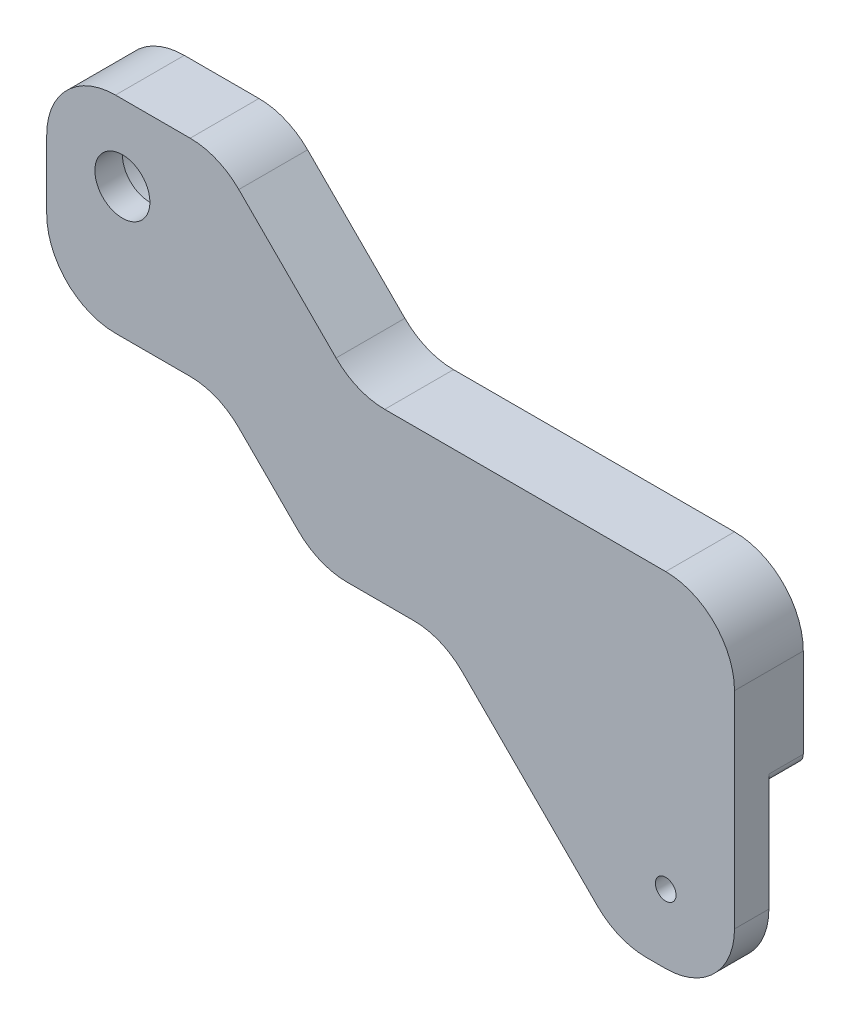
from build123d import *

# Parameters (mm, degrees)
ESQUISSE1_W                  = 200
ESQUISSE1_H                  = 100
BOSS_EXTRU_1_DEPTH           = 20
ENL_V_MAT_EXTRU_1_DEPTH      = 225.499443206
ENL_V_MAT_EXTRU_1_DEPTH_BACK = 225.499443206
ESQUISSE2_R                  = 3
ENL_V_MAT_EXTRU_2_DEPTH      = 225.499443206
ENL_V_MAT_EXTRU_2_DEPTH_BACK = 225.499443206
ENL_V_MAT_EXTRU_3_DEPTH      = 10
ENL_V_MAT_EXTRU_4_DEPTH      = 224.830292856
ENL_V_MAT_EXTRU_4_DEPTH_BACK = 224.830292856
BOSS_EXTRU_2_DEPTH           = 20
ESQUISSE7_R                  = 17.5
ENL_V_MAT_EXTRU_5_DEPTH      = 11
ENL_V_MAT_EXTRU_6_DEPTH      = 245.378804318
ENL_V_MAT_EXTRU_6_DEPTH_BACK = 245.378804318
ESQUISSE8_R                  = 8
ESQUISSE9_R                  = 14.5
ENL_V_MAT_EXTRU_7_DEPTH      = 1
CONG_1_R                     = 20
CONG_2_R                     = 3


with BuildPart() as part:
    # Esquisse1 → Boss.-Extru.1 (new body)
    with BuildSketch(Plane.XY):
        with Locations((100, 50)):
            Rectangle(ESQUISSE1_W, ESQUISSE1_H)
    extrude(amount=BOSS_EXTRU_1_DEPTH)

    # Esquisse2 → Enlèv. mat.-Extru.1 (cut, two sides: drawn at the far end of the back side and taken through both)
    with BuildSketch(Plane.XY.offset(20).offset(-ENL_V_MAT_EXTRU_1_DEPTH_BACK)):
        with Locations((180, 20)):
            Circle(ESQUISSE2_R)
    extrude(amount=ENL_V_MAT_EXTRU_1_DEPTH + ENL_V_MAT_EXTRU_1_DEPTH_BACK, mode=Mode.SUBTRACT)

    # Esquisse3 → Enlèv. mat.-Extru.2 (cut, two sides: drawn at the far end of the back side and taken through both)
    with BuildSketch(Plane.XY.offset(20).offset(-ENL_V_MAT_EXTRU_2_DEPTH_BACK)):
        Polygon((130, 0), (50, 80), (0, 80), (0, 0), align=None)
    extrude(amount=ENL_V_MAT_EXTRU_2_DEPTH + ENL_V_MAT_EXTRU_2_DEPTH_BACK, mode=Mode.SUBTRACT)

    # Esquisse4 → Enlèv. mat.-Extru.3 (cut)
    with BuildSketch(Plane(origin=(0, 0, 0), x_dir=(-1, 0, 0), z_dir=(0, 0, -1))):
        Polygon((-130, 0), (-79, 51), (-200, 51), (-200, 0), align=None)
    extrude(amount=-ENL_V_MAT_EXTRU_3_DEPTH, mode=Mode.SUBTRACT)

    # Esquisse5 → Enlèv. mat.-Extru.4 (cut, two sides: drawn at the far end of the back side and taken through both)
    with BuildSketch(Plane(origin=(0, 0, 10), x_dir=(-1, 0, 0), z_dir=(0, 0, -1)).offset(-ENL_V_MAT_EXTRU_4_DEPTH_BACK)):
        Polygon((-130, 0), (-166, 0), (-115, 51), (-79, 51), align=None)
    extrude(amount=ENL_V_MAT_EXTRU_4_DEPTH + ENL_V_MAT_EXTRU_4_DEPTH_BACK, mode=Mode.SUBTRACT)

    # Esquisse6 → Boss.-Extru.2 (add)
    with BuildSketch(Plane.XY.offset(20)):
        Polygon((0, 100), (90, 100), (50, 140), (0, 140), align=None)
    extrude(amount=-BOSS_EXTRU_2_DEPTH)

    # Esquisse7 → Enlèv. mat.-Extru.5 (cut)
    with BuildSketch(Plane(origin=(0, 0, 0), x_dir=(-1, 0, 0), z_dir=(0, 0, -1))):
        with Locations((-22, 118)):
            Circle(ESQUISSE7_R)
    extrude(amount=-ENL_V_MAT_EXTRU_5_DEPTH, mode=Mode.SUBTRACT)

    # Esquisse8 → Enlèv. mat.-Extru.6 (cut, two sides: drawn at the far end of the back side and taken through both)
    with BuildSketch(Plane(origin=(0, 0, 11), x_dir=(-1, 0, 0), z_dir=(0, 0, -1)).offset(-ENL_V_MAT_EXTRU_6_DEPTH_BACK)):
        with Locations((-22, 118)):
            Circle(ESQUISSE8_R)
    extrude(amount=ENL_V_MAT_EXTRU_6_DEPTH + ENL_V_MAT_EXTRU_6_DEPTH_BACK, mode=Mode.SUBTRACT)

    # Esquisse9 → Enlèv. mat.-Extru.7 (cut)
    with BuildSketch(Plane(origin=(0, 0, 11), x_dir=(-1, 0, 0), z_dir=(0, 0, -1))):
        with Locations((-22, 118)):
            Circle(ESQUISSE9_R)
    extrude(amount=-ENL_V_MAT_EXTRU_7_DEPTH, mode=Mode.SUBTRACT)

    # Congé1
    cong_1_edges = [part.edges().sort_by_distance(p)[0] for p in [
        (0, 80, 10),
        (50, 80, 10),
        (79, 51, 10),
        (115, 51, 15),
        (166, 0, 15),
        (200, 100, 10),
        (0, 140, 10),
        (200, 0, 15),
        (50, 140, 10),
        (90, 100, 10),
    ]]
    fillet(cong_1_edges, radius=CONG_1_R)

    # Congé2
    cong_2_edges = [part.edges().sort_by_distance(p)[0] for p in [
        (200, 51, 5),
    ]]
    fillet(cong_2_edges, radius=CONG_2_R)


solid = part.part
